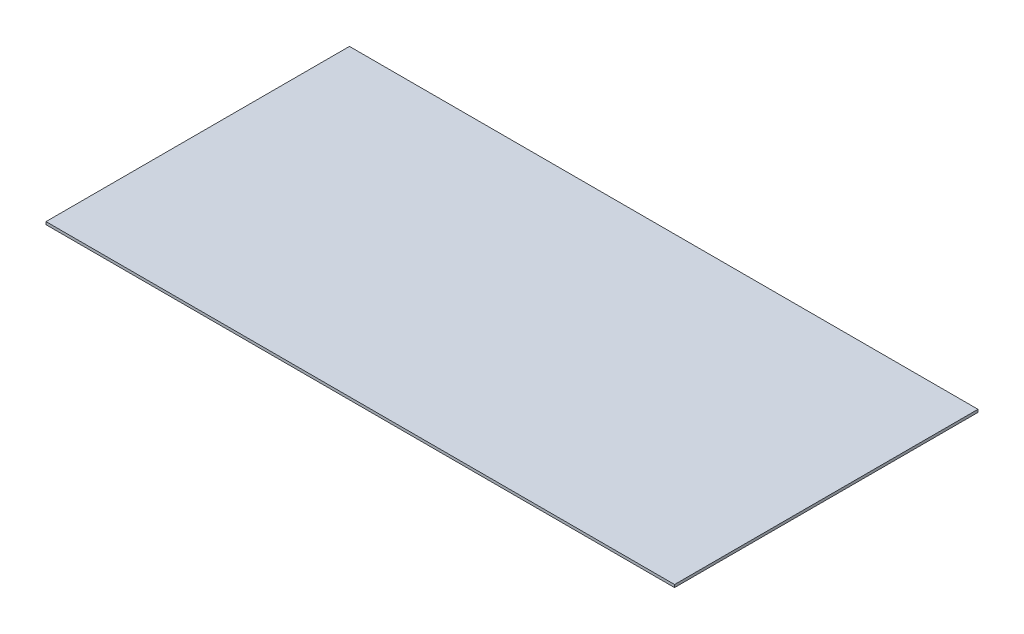
from build123d import *

# Parameters (mm, degrees)
SKETCH1_W           = 736.6
SKETCH1_H           = 355.6
BOSS_EXTRUDE1_DEPTH = 3.175


with BuildPart() as part:
    # Sketch1 → Boss-Extrude1 (new body)
    with BuildSketch(Plane(origin=(0, 0, 0), x_dir=(1, 0, 0), z_dir=(0, 1, 0))):
        with Locations((368.3, 177.8)):
            Rectangle(SKETCH1_W, SKETCH1_H)
    extrude(amount=BOSS_EXTRUDE1_DEPTH)


solid = part.part
